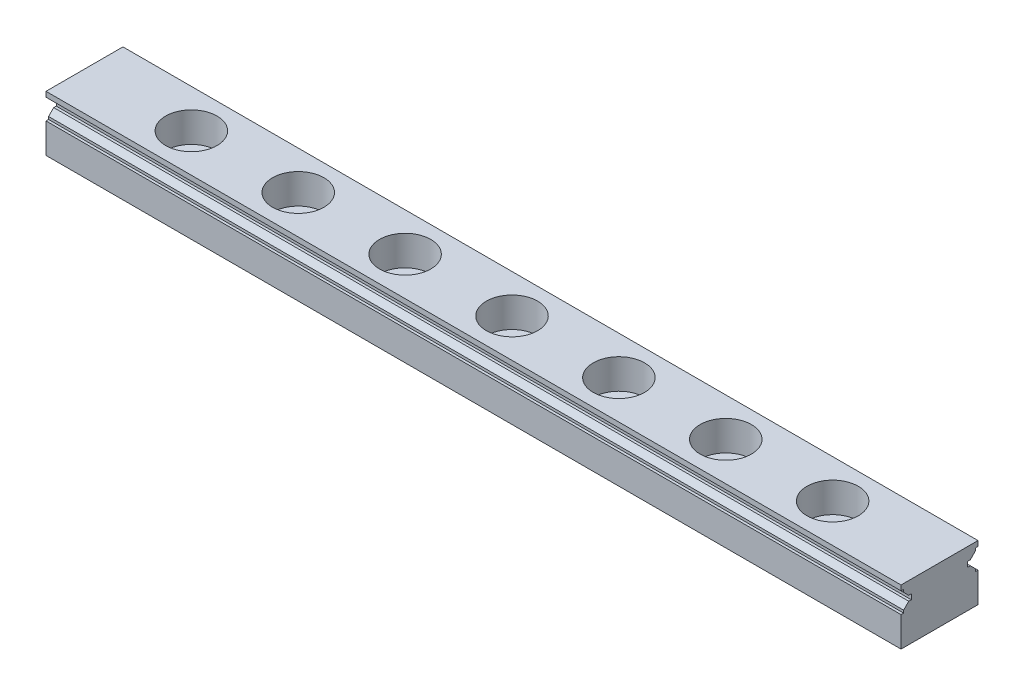
from build123d import *

# Parameters (mm, degrees)
BOSS_EXTRU_1_DEPTH                                 = 100
ESQUISSE2_W                                        = 0.3
ESQUISSE2_H                                        = 2.4
ENL_V_MAT_EXTRU_1_DEPTH                            = 101.312013239
CHAMBRAGE_POUR_VIS_T_TE_HEXAGONALE_M31_D           = 3.5
CHAMBRAGE_POUR_VIS_T_TE_HEXAGONALE_M31_CBORE_D     = 6
CHAMBRAGE_POUR_VIS_T_TE_HEXAGONALE_M31_CBORE_DEPTH = 3.5
R_P_TITION_LIN_AIRE1_COUNT                         = 7
R_P_TITION_LIN_AIRE1_PITCH                         = 12.5


with BuildPart() as part:
    # Esquisse1 → Boss.-Extru.1 (new body)
    with BuildSketch(Plane(origin=(0, 0, 0), x_dir=(0, 0, -1), z_dir=(1, 0, 0))):
        Polygon((-4.5, 0), (4.5, 0), (4.5, 3.5), (3.6, 4.4), (3.3, 4.4), (3.3, 5), (3.6, 5), (4.5, 5.9), (4.5, 6.5), (-4.5, 6.5), (-4.5, 5.9), (-3.6, 5), (-3.3, 5), (-3.3, 4.4), (-3.6, 4.4), (-4.5, 3.5), align=None)
    extrude(amount=BOSS_EXTRU_1_DEPTH)

    # Esquisse2 → Enlèv. mat.-Extru.1 (cut, through all)
    with BuildSketch(Plane(origin=(0, 0, 0), x_dir=(0, 0, -1), z_dir=(1, 0, 0))):
        with Locations((4.35, 4.7)):
            Rectangle(ESQUISSE2_W, ESQUISSE2_H)
        with Locations((-4.35, 4.7)):
            Rectangle(ESQUISSE2_W, ESQUISSE2_H)
    extrude(amount=ENL_V_MAT_EXTRU_1_DEPTH, mode=Mode.SUBTRACT)

    # Chambrage pour vis à tête hexagonale M31 (through all)
    with Locations(Plane(origin=(0, 6.5, 0), x_dir=(1, 0, 0), z_dir=(0, 1, 0))):
        with Locations((12.5, 0)):
            chambrage_pour_vis_t_te_hexagonale_m31 = CounterBoreHole(CHAMBRAGE_POUR_VIS_T_TE_HEXAGONALE_M31_D / 2, CHAMBRAGE_POUR_VIS_T_TE_HEXAGONALE_M31_CBORE_D / 2, CHAMBRAGE_POUR_VIS_T_TE_HEXAGONALE_M31_CBORE_DEPTH)

    # Répétition linéaire1: Chambrage pour vis à tête hexagonale M31 ×7
    with Locations(*[(i * R_P_TITION_LIN_AIRE1_PITCH, 0, 0) for i in range(1, R_P_TITION_LIN_AIRE1_COUNT)]):
        add(chambrage_pour_vis_t_te_hexagonale_m31, mode=Mode.SUBTRACT)


solid = part.part
